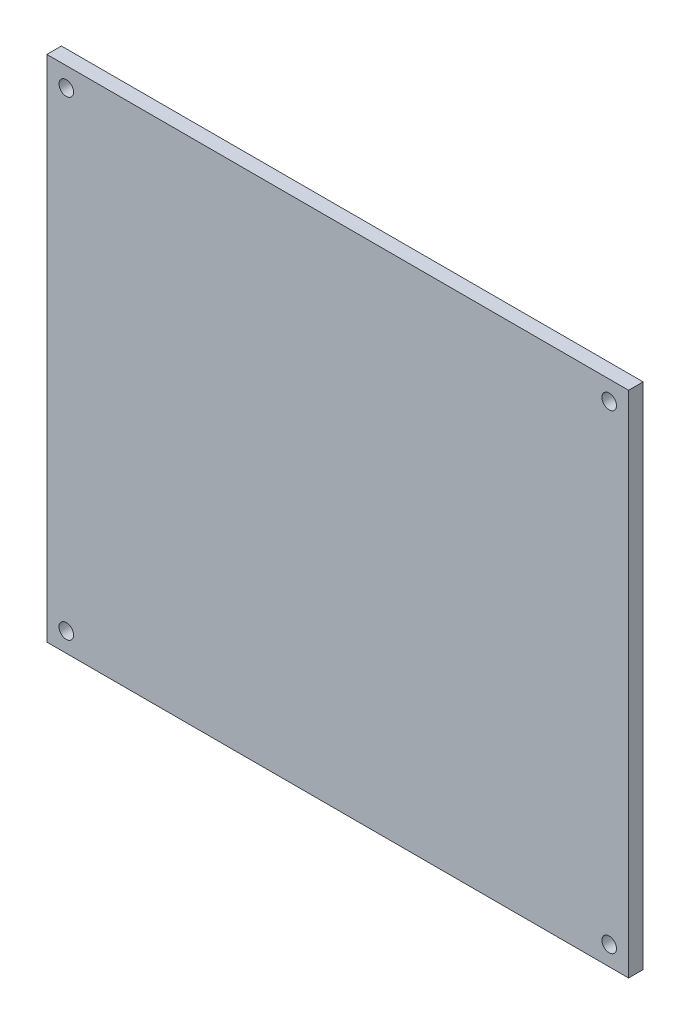
from build123d import *

# Parameters (mm, degrees)
SKETCH_1_W          = 120
SKETCH_1_H          = 105
EXTRUDE_1_DEPTH     = 3
SKETCH_2_R          = 1.5
CUT_EXTRUDE_1_DEPTH = 10


with BuildPart() as part:
    # 草图1 → 凸台-拉伸1 (new body)
    with BuildSketch(Plane.XY):
        Rectangle(SKETCH_1_W, SKETCH_1_H)
    extrude(amount=EXTRUDE_1_DEPTH)

    # 草图2 → 切除-拉伸1 (cut)
    with BuildSketch(Plane.XY.offset(3)):
        with Locations((-56, 48.5)):
            Circle(SKETCH_2_R)
        with Locations((56, 48.5)):
            Circle(SKETCH_2_R)
        with Locations((56, -48.5)):
            Circle(SKETCH_2_R)
        with Locations((-56, -48.5)):
            Circle(SKETCH_2_R)
    extrude(amount=-CUT_EXTRUDE_1_DEPTH, mode=Mode.SUBTRACT)


solid = part.part
